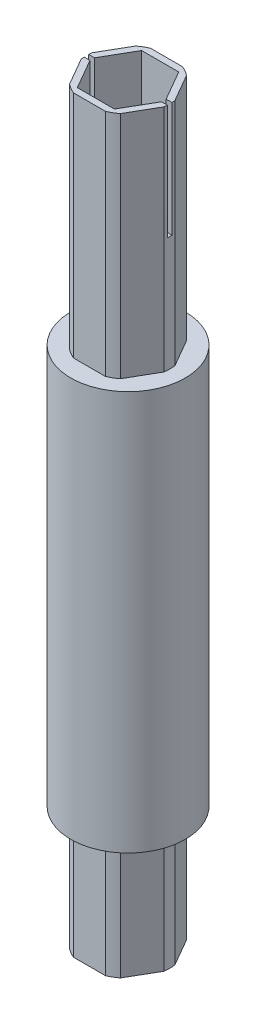
from build123d import *

# Parameters (mm, degrees)
BOSS_EXTRUDE1_DEPTH = 19.812
SKETCH2_R           = 9.5
BOSS_EXTRUDE2_DEPTH = 66.294
BOSS_EXTRUDE6_START = 104.394
BOSS_EXTRUDE6_DEPTH = 104.394
SKETCH6_W           = 13.85
SKETCH6_H           = 0.762
CUT_EXTRUDE1_DEPTH  = 19.05
CUT_EXTRUDE2_DEPTH  = 27.397749878


with BuildPart() as part:
    # Sketch1 → Boss-Extrude1 (new body)
    with BuildSketch(Plane(origin=(0, 0, 0), x_dir=(1, 0, 0), z_dir=(0, 1, 0))):
        with BuildLine():
            Line((6.86474929, 0.911505448), (4.221761519, 5.489294552))
            ThreePointArc((4.221761519, 5.489294552), (3.4625, 5.997225921), (2.642987771, 6.4008))
            Line((2.642987771, 6.4008), (-2.642987771, 6.4008))
            ThreePointArc((-2.642987771, 6.4008), (-3.4625, 5.997225921), (-4.221761519, 5.489294552))
            Line((-4.221761519, 5.489294552), (-6.86474929, 0.911505448))
            ThreePointArc((-6.86474929, 0.911505448), (-6.925, 0), (-6.86474929, -0.911505448))
            Line((-6.86474929, -0.911505448), (-4.221761519, -5.489294552))
            ThreePointArc((-4.221761519, -5.489294552), (-3.4625, -5.997225921), (-2.642987771, -6.4008))
            Line((-2.642987771, -6.4008), (2.642987771, -6.4008))
            ThreePointArc((2.642987771, -6.4008), (3.4625, -5.997225921), (4.221761519, -5.489294552))
            Line((4.221761519, -5.489294552), (6.86474929, -0.911505448))
            ThreePointArc((6.86474929, -0.911505448), (6.925, 0), (6.86474929, 0.911505448))
        make_face()
    extrude(amount=-BOSS_EXTRUDE1_DEPTH)

    # Sketch2 → Boss-Extrude2 (add)
    with BuildSketch(Plane(origin=(0, 0, 0), x_dir=(-1, 0, 0), z_dir=(0, -1, 0))):
        Circle(SKETCH2_R)
    extrude(amount=-BOSS_EXTRUDE2_DEPTH)

    # Sketch1<4> → Boss-Extrude6 (add)
    with BuildSketch(Plane(origin=(0, 0, 0), x_dir=(1, 0, 0), z_dir=(0, 1, 0)).offset(BOSS_EXTRUDE6_START)):
        with BuildLine():
            Line((6.86474929, 0.911505448), (4.221761519, 5.489294552))
            ThreePointArc((4.221761519, 5.489294552), (3.4625, 5.997225921), (2.642987771, 6.4008))
            Line((2.642987771, 6.4008), (-2.642987771, 6.4008))
            ThreePointArc((-2.642987771, 6.4008), (-3.4625, 5.997225921), (-4.221761519, 5.489294552))
            Line((-4.221761519, 5.489294552), (-6.86474929, 0.911505448))
            ThreePointArc((-6.86474929, 0.911505448), (-6.925, 0), (-6.86474929, -0.911505448))
            Line((-6.86474929, -0.911505448), (-4.221761519, -5.489294552))
            ThreePointArc((-4.221761519, -5.489294552), (-3.4625, -5.997225921), (-2.642987771, -6.4008))
            Line((-2.642987771, -6.4008), (2.642987771, -6.4008))
            ThreePointArc((2.642987771, -6.4008), (3.4625, -5.997225921), (4.221761519, -5.489294552))
            Line((4.221761519, -5.489294552), (6.86474929, -0.911505448))
            ThreePointArc((6.86474929, -0.911505448), (6.925, 0), (6.86474929, 0.911505448))
        make_face()
    extrude(amount=-BOSS_EXTRUDE6_DEPTH)

    # Sketch6 → Cut-Extrude1 (cut)
    with BuildSketch(Plane(origin=(0, 104.394, 0), x_dir=(1, 0, 0), z_dir=(0, 1, 0))):
        Rectangle(SKETCH6_W, SKETCH6_H)
    extrude(amount=-CUT_EXTRUDE1_DEPTH, mode=Mode.SUBTRACT)

    # Sketch7 → Cut-Extrude2 (cut)
    with BuildSketch(Plane(origin=(0, 104.394, 0), x_dir=(1, 0, 0), z_dir=(0, 1, 0))):
        Polygon((3.079586336, 5.334), (-3.079586336, 5.334), (-6.159172672, 0), (-3.079586336, -5.334), (3.079586336, -5.334), (6.159172672, 0), align=None)
    extrude(amount=-CUT_EXTRUDE2_DEPTH, mode=Mode.SUBTRACT)


solid = part.part
